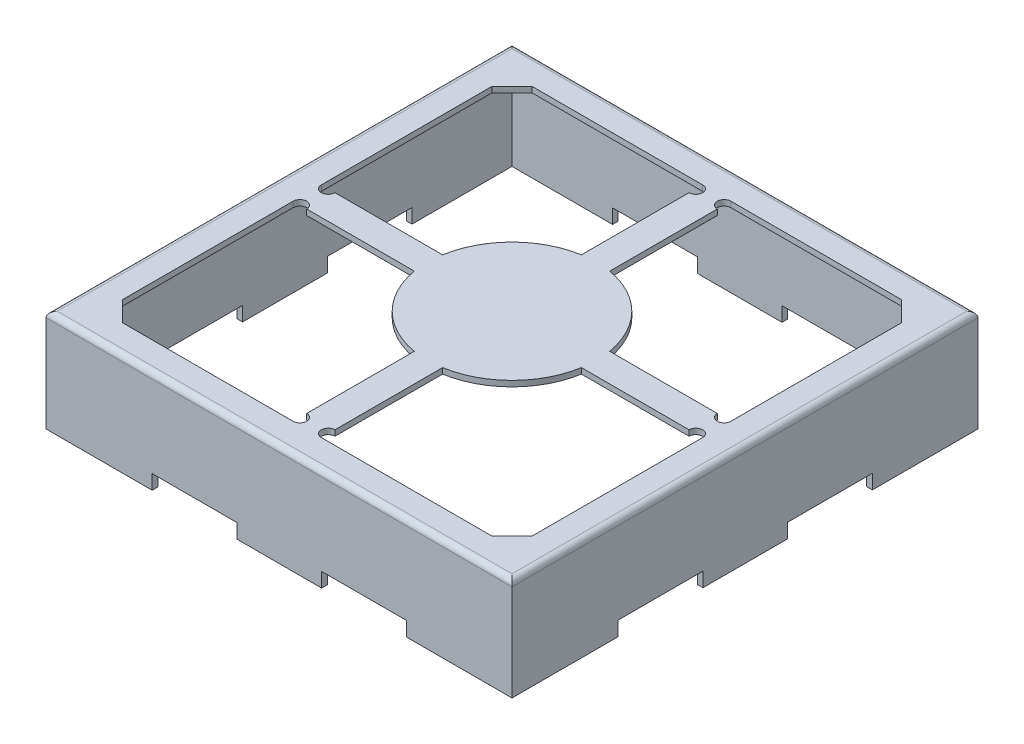
from build123d import *

# Parameters (mm, degrees)
SKETCH_1_W          = 16.1
SKETCH_1_H          = 16.1
EXTRUDE_1_DEPTH     = 0.2
SKETCH_2_W          = 16.5
SKETCH_2_H          = 16.5
SKETCH_2_W_2        = 16.1
SKETCH_2_H_2        = 16.1
EXTRUDE_2_DEPTH     = 3.61
FILLET_1_R          = 0.2
SKETCH_3_W          = 0.2
SKETCH_3_H          = 3
SKETCH_3_W_2        = 3
SKETCH_3_H_2        = 0.2
CUT_EXTRUDE_1_DEPTH = 0.51


with BuildPart() as part:
    # 草图1 → 凸台-拉伸1 (new body)
    with BuildSketch(Plane(origin=(0, 0, 0), x_dir=(1, 0, 0), z_dir=(0, 1, 0))):
        with Locations((8.25, -8.25)):
            Rectangle(SKETCH_1_W, SKETCH_1_H)
        with BuildLine():
            Line((1.706516818, -15.5), (1, -14.793483182))
            Line((1, -14.793483182), (1, -8.75))
            ThreePointArc((1, -8.75), (1.24, -8.51), (1.48, -8.75))
            Line((1.48, -8.75), (5.291960108, -8.75))
            ThreePointArc((5.291960108, -8.75), (6.128679656, -10.371320344), (7.75, -11.208039892))
            Line((7.75, -11.208039892), (7.75, -15.02))
            ThreePointArc((7.75, -15.02), (7.99, -15.26), (7.75, -15.5))
            Line((7.75, -15.5), (1.706516818, -15.5))
        make_face(mode=Mode.SUBTRACT)
        with BuildLine():
            Line((5.291960108, -7.75), (1.48, -7.75))
            ThreePointArc((1.48, -7.75), (1.24, -7.99), (1, -7.75))
            Line((1, -7.75), (1, -1.706516818))
            Line((1, -1.706516818), (1.706516818, -1))
            Line((1.706516818, -1), (7.75, -1))
            ThreePointArc((7.75, -1), (7.99, -1.24), (7.75, -1.48))
            Line((7.75, -1.48), (7.75, -5.291960108))
            ThreePointArc((7.75, -5.291960108), (6.128679656, -6.128679656), (5.291960108, -7.75))
        make_face(mode=Mode.SUBTRACT)
        with BuildLine():
            Line((8.75, -1), (14.793483182, -1))
            Line((14.793483182, -1), (15.5, -1.706516818))
            Line((15.5, -1.706516818), (15.5, -7.75))
            ThreePointArc((15.5, -7.75), (15.26, -7.99), (15.02, -7.75))
            Line((15.02, -7.75), (11.208039892, -7.75))
            ThreePointArc((11.208039892, -7.75), (10.371320344, -6.128679656), (8.75, -5.291960108))
            Line((8.75, -5.291960108), (8.75, -1.48))
            ThreePointArc((8.75, -1.48), (8.51, -1.24), (8.75, -1))
        make_face(mode=Mode.SUBTRACT)
        with BuildLine():
            Line((15.5, -8.75), (15.5, -14.793483182))
            Line((15.5, -14.793483182), (14.793483182, -15.5))
            Line((14.793483182, -15.5), (8.75, -15.5))
            ThreePointArc((8.75, -15.5), (8.51, -15.26), (8.75, -15.02))
            Line((8.75, -15.02), (8.75, -11.208039892))
            ThreePointArc((8.75, -11.208039892), (10.371320344, -10.371320344), (11.208039892, -8.75))
            Line((11.208039892, -8.75), (15.02, -8.75))
            ThreePointArc((15.02, -8.75), (15.26, -8.51), (15.5, -8.75))
        make_face(mode=Mode.SUBTRACT)
    extrude(amount=-EXTRUDE_1_DEPTH)

    # 草图2 → 凸台-拉伸2 (add)
    with BuildSketch(Plane(origin=(0, 0, 0), x_dir=(1, 0, 0), z_dir=(0, 1, 0))):
        with Locations((8.25, -8.25)):
            Rectangle(SKETCH_2_W, SKETCH_2_H)
        with Locations((8.25, -8.25)):
            Rectangle(SKETCH_2_W_2, SKETCH_2_H_2, mode=Mode.SUBTRACT)
    extrude(amount=-EXTRUDE_2_DEPTH)

    # 圆角1
    fillet_1_edges = [part.edges().sort_by_distance(p)[0] for p in [
        (16.5, 0, 8.25),
        (8.25, 0, 0),
        (0, 0, 8.25),
        (8.25, 0, 16.5),
    ]]
    fillet(fillet_1_edges, radius=FILLET_1_R)

    # 草图3 → 切除-拉伸1 (cut)
    with BuildSketch(Plane.XZ.offset(3.61)):
        with Locations((0.1, 11.24)):
            Rectangle(SKETCH_3_W, SKETCH_3_H)
        with Locations((0.1, 5.24)):
            Rectangle(SKETCH_3_W, SKETCH_3_H)
        with Locations((16.4, 11.24)):
            Rectangle(SKETCH_3_W, SKETCH_3_H)
        with Locations((16.4, 5.24)):
            Rectangle(SKETCH_3_W, SKETCH_3_H)
        with Locations((5.26, 16.4)):
            Rectangle(SKETCH_3_W_2, SKETCH_3_H_2)
        with Locations((11.26, 16.4)):
            Rectangle(SKETCH_3_W_2, SKETCH_3_H_2)
        with Locations((11.26, 0.1)):
            Rectangle(SKETCH_3_W_2, SKETCH_3_H_2)
        with Locations((5.26, 0.1)):
            Rectangle(SKETCH_3_W_2, SKETCH_3_H_2)
    extrude(amount=-CUT_EXTRUDE_1_DEPTH, mode=Mode.SUBTRACT)


solid = part.part
